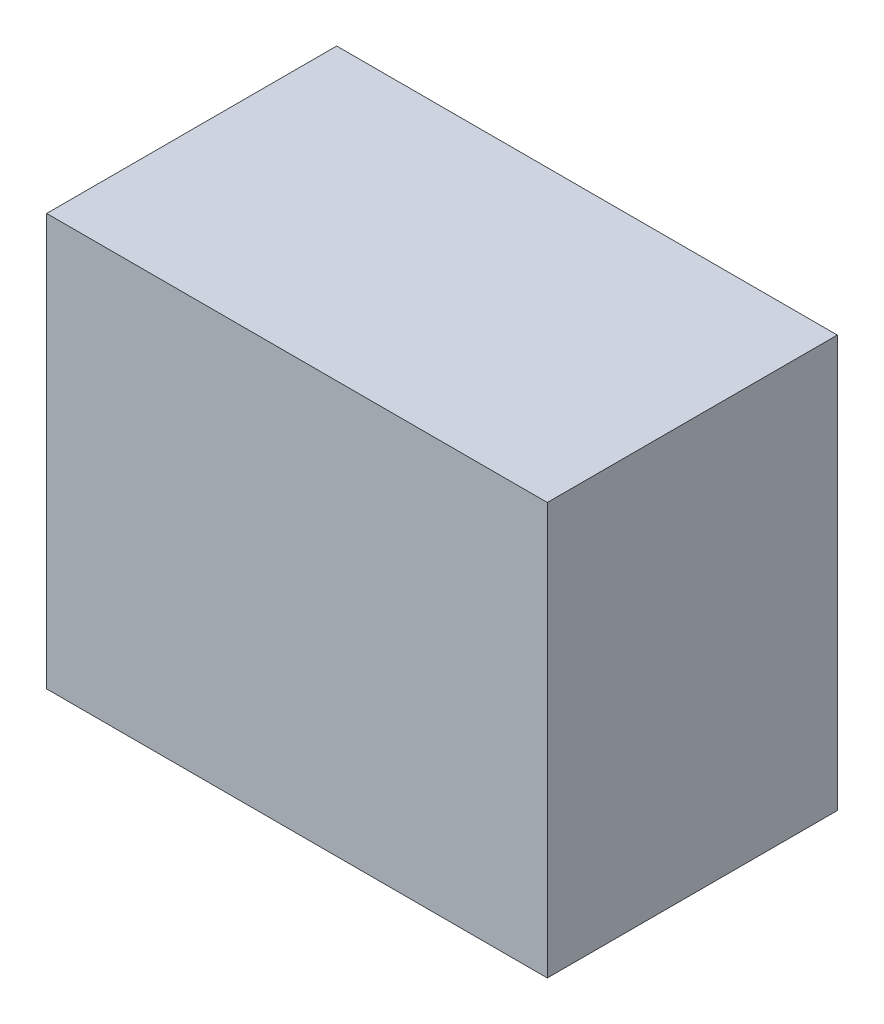
from build123d import *

# Parameters (mm, degrees)
SKETCH3_W                      = 21.924187445
SKETCH3_H                      = 19.837641971
BOSS_EXTRUDE1_DEPTH            = 6.35
SKETCH4_R                      = 3.175
CUT_EXTRUDE1_DEPTH             = 9.525
SKETCH5_R                      = 3.175
CUT_EXTRUDE5_DEPTH             = 9.525
CUT_EXTRUDE5_DIRECTION_2_REACH = 27.174
SKETCH6_R                      = 3.175
CUT_EXTRUDE6_DEPTH             = 9.525
SKETCH7_W                      = 12.7
SKETCH7_H                      = 1.803641971
CUT_EXTRUDE7_DEPTH             = 31.241106695


with BuildPart() as part:
    # Sketch3 → Boss-Extrude1 (new, symmetric)
    with BuildSketch(Plane.XY):
        with Locations((10.962093723, -9.918820986)):
            Rectangle(SKETCH3_W, SKETCH3_H)
    extrude(amount=BOSS_EXTRUDE1_DEPTH, both=True)

    # Sketch4 → Cut-Extrude1 (cut)
    with BuildSketch(Plane.ZY):
        with Locations(Location((0, -6.35, 0), (0, 0, 270))):
            Circle(SKETCH4_R)
    extrude(amount=-CUT_EXTRUDE1_DEPTH, mode=Mode.SUBTRACT)

    # Sketch5 → Cut-Extrude5 (cut)
    with BuildSketch(Plane(origin=(7.787093723, -19.837641971, 0), x_dir=(-0.8660254037844382, 0.500000000000001, 0), z_dir=(-0.500000000000001, -0.8660254037844382, 0))):
        with Locations(Location((0, 0, 0), (0, 0, 180))):
            Circle(SKETCH5_R)
    extrude(amount=-CUT_EXTRUDE5_DEPTH, mode=Mode.SUBTRACT)

    # Sketch5 → Cut-Extrude5 direction 2 (cut, up to next)
    with BuildSketch(Plane(origin=(7.787093723, -19.837641971, 0), x_dir=(-0.8660254037844382, 0.500000000000001, 0), z_dir=(-0.500000000000001, -0.8660254037844382, 0)), mode=Mode.PRIVATE) as cut_extrude5_direction_2_sk1:
        with Locations(Location((0, 0, 0), (0, 0, 180))):
            Circle(SKETCH5_R)
    cut_extrude5_direction_2_tool1 = extrude(cut_extrude5_direction_2_sk1.sketch, amount=CUT_EXTRUDE5_DIRECTION_2_REACH, mode=Mode.PRIVATE) & part.part
    add(cut_extrude5_direction_2_tool1.solids().sort_by_distance((7.787094, -19.837642, 0))[0], mode=Mode.SUBTRACT)

    # Sketch6 → Cut-Extrude6 (cut)
    with BuildSketch(Plane(origin=(0, 0, -6.35), x_dir=(-1, 0, 0), z_dir=(0, 0, -1))):
        with Locations((-15.574187445, -6.35)):
            Circle(SKETCH6_R)
    extrude(amount=-CUT_EXTRUDE6_DEPTH, mode=Mode.SUBTRACT)

    # Sketch7 → Cut-Extrude7 (cut, through all)
    with BuildSketch(Plane(origin=(21.924187445, 0, 0), x_dir=(0, 0, -1), z_dir=(1, 0, 0))):
        with Locations((0, -18.935820986)):
            Rectangle(SKETCH7_W, SKETCH7_H)
    extrude(amount=-CUT_EXTRUDE7_DEPTH, mode=Mode.SUBTRACT)


solid = part.part
